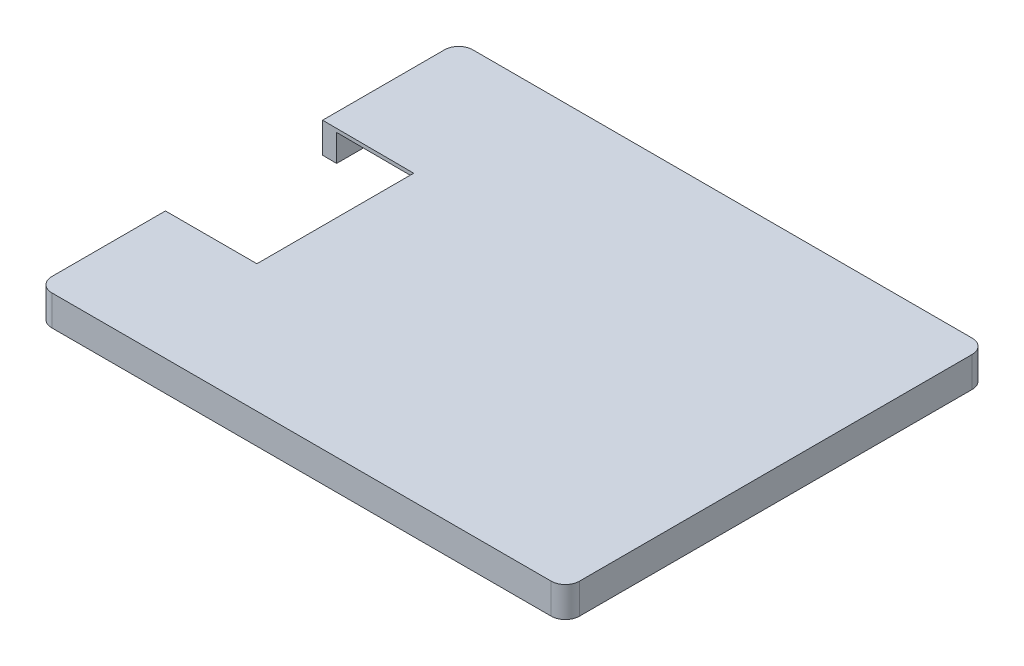
from build123d import *

# Parameters (mm, degrees)
SKETCH2_W           = 74.7
SKETCH2_H           = 59.6
SKETCH2_W_2         = 70.7
SKETCH2_H_2         = 55.6
WALLS_DEPTH         = 3.8
SKETCH3_W           = 59.6
SKETCH3_H           = 0.5
BOSS_EXTRUDE2_DEPTH = 74.7
CUT_EXTRUDE1_REACH  = 93.449
FILLET1_R           = 2


with BuildPart() as part:
    # Sketch2 → walls (new body)
    with BuildSketch(Plane(origin=(0, 15.5, 0), x_dir=(1, 0, 0), z_dir=(0, 1, 0))):
        with Locations((34.35, 26.8)):
            Rectangle(SKETCH2_W, SKETCH2_H)
        with Locations((34.35, 26.8)):
            Rectangle(SKETCH2_W_2, SKETCH2_H_2, mode=Mode.SUBTRACT)
    extrude(amount=WALLS_DEPTH)

    # Sketch3 → Boss-Extrude2 (add)
    with BuildSketch(Plane(origin=(71.7, 0, 0), x_dir=(0, 0, -1), z_dir=(1, 0, 0))):
        with Locations((26.8, 19.55)):
            Rectangle(SKETCH3_W, SKETCH3_H)
    extrude(amount=-BOSS_EXTRUDE2_DEPTH)

    # Sketch4 → Cut-Extrude1 (cut, up to next)
    with BuildSketch(Plane(origin=(0, 15.5, 0), x_dir=(1, 0, 0), z_dir=(0, 1, 0)), mode=Mode.PRIVATE) as cut_extrude1_sk1:
        Polygon((9.95, 37.282193212), (-3, 37.335), (-3, 15.085), (9.95, 15.085), align=None)
    cut_extrude1_tool1 = extrude(cut_extrude1_sk1.sketch, amount=CUT_EXTRUDE1_REACH, mode=Mode.PRIVATE) & part.part
    add(cut_extrude1_tool1.solids().sort_by_distance((3.472436, 15.5, -26.196804))[0], mode=Mode.SUBTRACT)

    # Fillet1
    fillet1_edges = [part.edges().sort_by_distance(p)[0] for p in [
        (71.7, 17.65, -56.6),
        (71.7, 17.65, 3),
        (-3, 17.65, 3),
        (-3, 17.65, -56.6),
    ]]
    fillet(fillet1_edges, radius=FILLET1_R)


solid = part.part
